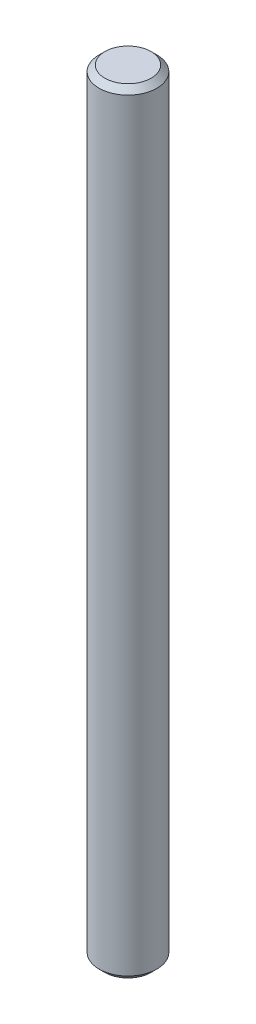
from build123d import *

# Parameters (mm, degrees)
SKETCH1_R           = 2.5
BOSS_EXTRUDE1_DEPTH = 67
CHAMFER1_SIZE       = 0.5


with BuildPart() as part:
    # Sketch1 → Boss-Extrude1 (new body)
    with BuildSketch(Plane(origin=(0, 0, 0), x_dir=(1, 0, 0), z_dir=(0, 1, 0))):
        with Locations(Location((0, 0, 0), (0, 0, 270))):
            Circle(SKETCH1_R)
    extrude(amount=BOSS_EXTRUDE1_DEPTH)

    # Chamfer1
    chamfer1_edges = [part.edges().sort_by_distance(p)[0] for p in [
        (0, 0, -2.5),
        (0, 67, -2.5),
    ]]
    chamfer(chamfer1_edges, length=CHAMFER1_SIZE)


solid = part.part
